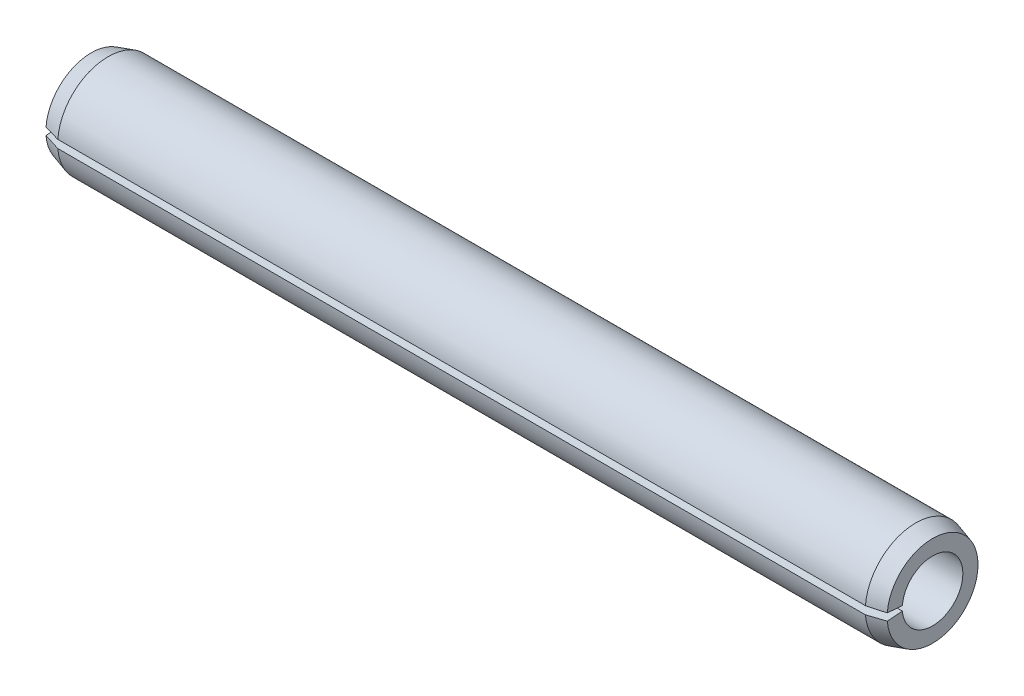
from build123d import *

# Parameters (mm, degrees)
GAP_DEPTH = 26.089838581


with BuildPart() as part:
    # Sketch1 → Base-Revolve (revolve)
    with BuildSketch(Plane.XY, mode=Mode.PRIVATE) as base_revolve_sk:
        Polygon((0, 0.9), (25, 0.9), (25, 1.35), (24.5, 1.5), (0.5, 1.5), (0, 1.35), align=None)
    revolve(base_revolve_sk.sketch.rotate(Axis((-9.525, 0, 0), (1, 0, 0)), 90), axis=Axis((-9.525, 0, 0), (1, 0, 0)))

    # Sketch2 → Gap (cut, through all)
    with BuildSketch(Plane(origin=(0, 0, 0), x_dir=(0, -1, 0), z_dir=(-1, 0, 0))):
        with BuildLine():
            Line((0, 0), (0.120042416, 1.525283521))
            ThreePointArc((0.120042416, 1.525283521), (0, 1.53), (-0.120042416, 1.525283521))
            Line((-0.120042416, 1.525283521), (0, 0))
        make_face()
    extrude(amount=-GAP_DEPTH, mode=Mode.SUBTRACT)


solid = part.part
